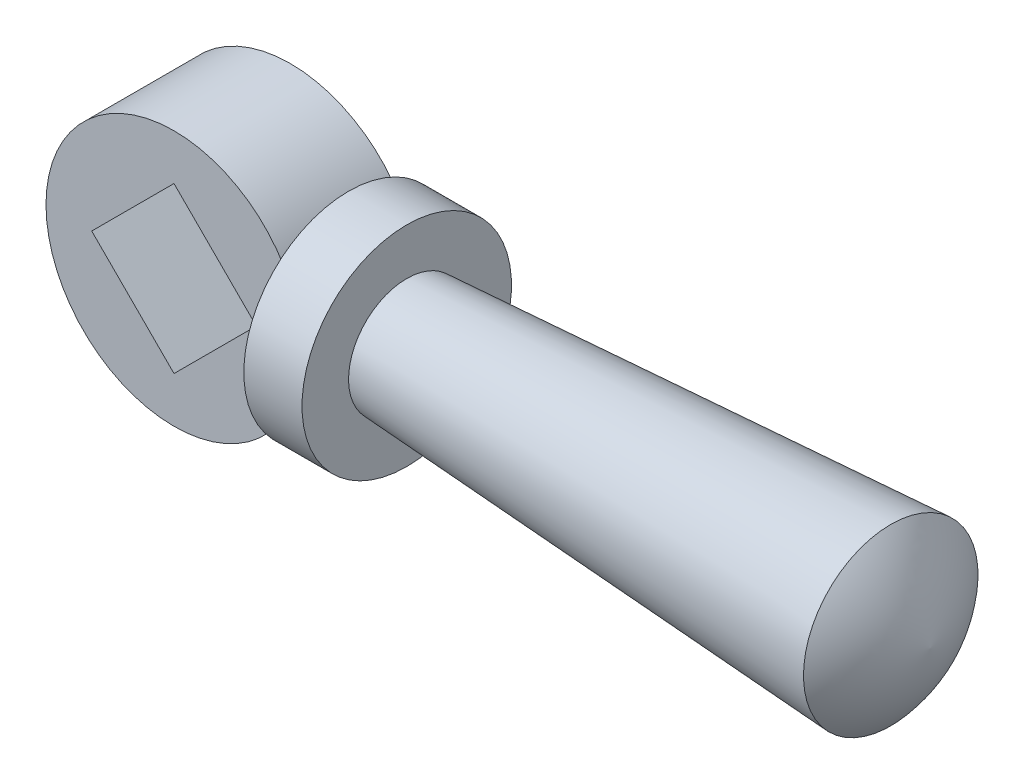
from build123d import *

# Parameters (mm, degrees)
EXTRUDE_1_DEPTH      = 5
EXTRUDE_1_DEPTH_BACK = 5
SKETCH_2_R           = 11


with BuildPart() as part:
    # Эскиз1 → Повернуть1 (revolve)
    with BuildSketch(Plane.XY):
        with BuildLine():
            Line((0, -1.817557224), (46.592714661, -1.817557224))
            Line((46.592714661, -1.817557224), (50, -1.817557224))
            ThreePointArc((50, -1.817557224), (48.821302227, -5.806042164), (46.592714661, -9.317557224))
            Line((46.592714661, -9.317557224), (5, -6.817557224))
            Line((5, -6.817557224), (5, -10.817557224))
            Line((5, -10.817557224), (0, -10.817557224))
            Line((0, -10.817557224), (0, -1.817557224))
        make_face()
    revolve(axis=Axis((0, -1.817557224, 0), (-1, 0, 0)))

    # Эскиз2 → Бобышка-Вытянуть1 (add, two sides: drawn at the far end of the back side and taken through both)
    with BuildSketch(Plane.XY.offset(-EXTRUDE_1_DEPTH_BACK)):
        with Locations((-10, -1.817557224)):
            Circle(SKETCH_2_R)
        Polygon((-10, 5.253510588), (-2.928932188, -1.817557224), (-10, -8.888625036), (-17.071067812, -1.817557224), align=None, mode=Mode.SUBTRACT)
    extrude(amount=EXTRUDE_1_DEPTH + EXTRUDE_1_DEPTH_BACK)


solid = part.part
